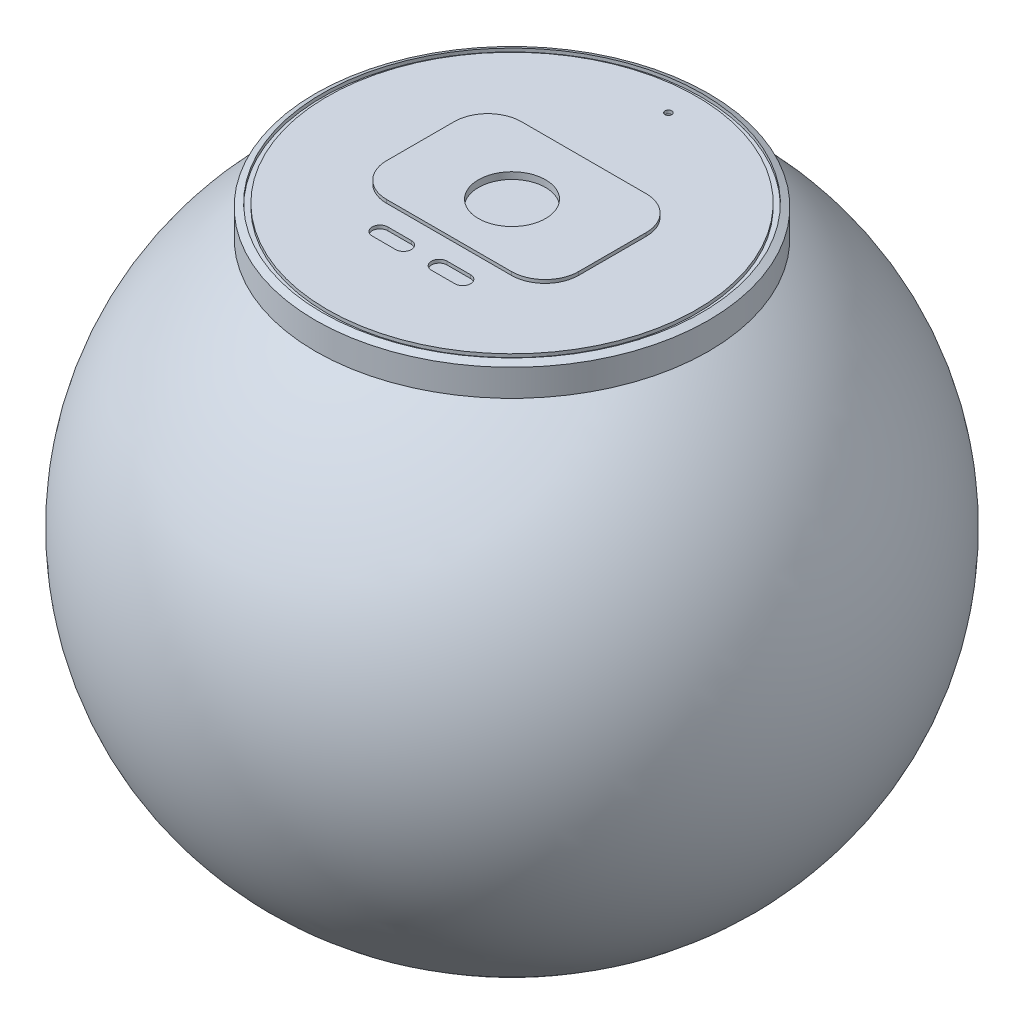
from build123d import *

# Parameters (mm, degrees)
CUT_EXTRUDE1_DEPTH      = 86.356590332
CUT_EXTRUDE1_DEPTH_BACK = 86.356590332
SKETCH9_R               = 28.237117721
BOSS_EXTRUDE3_DEPTH     = 4.5
SKETCH10_R              = 28.237117721
SKETCH10_R_2            = 27.47603731
CUT_EXTRUDE2_DEPTH      = 0.5
CUT_EXTRUDE4_DEPTH      = 0.5
CUT_EXTRUDE5_DEPTH      = 0.5
BOSS_EXTRUDE5_DEPTH     = 0.5
CUT_EXTRUDE7_DEPTH      = 0.5
CUT_EXTRUDE7_DEPTH_BACK = 0.5
SKETCH11_11_R           = 5
SKETCH11_12_R           = 0.5
CUT_EXTRUDE8_DEPTH      = 0.5


with BuildPart() as part:
    # Sketch1 → Revolve1 (revolve)
    with BuildSketch(Plane.XY):
        with BuildLine():
            Line((0, 49.509049853), (0, -35))
            Line((0, -35), (-25.272030651, -35))
            ThreePointArc((-25.272030651, -35), (-47.186298393, 17.586623254), (0, 49.509049853))
        make_face()
    revolve(axis=Axis((0, 0, 0), (0, 1, 0)))

    # Sketch2 → Cut-Extrude1 (cut, two sides: drawn at the far end of the back side and taken through both)
    with BuildSketch(Plane.XY.offset(-CUT_EXTRUDE1_DEPTH_BACK)):
        Polygon((57.527772065, 42), (57.527772065, 50), (-10, 50), (-49.614603295, 50), (-49.614603295, 42), align=None)
    extrude(amount=CUT_EXTRUDE1_DEPTH + CUT_EXTRUDE1_DEPTH_BACK, mode=Mode.SUBTRACT)

    # Sketch8 → Revolve2 (revolve)
    with BuildSketch(Plane.XY):
        Polygon((-29.237117721, 42), (-29.237117721, 46), (-28.237117721, 46.5), (-28.237117721, 42), align=None)
    revolve(axis=Axis((0, 0, 0), (0, 1, 0)))

    # Sketch9 → Boss-Extrude3 (add)
    with BuildSketch(Plane(origin=(0, 42, 0), x_dir=(1, 0, 0), z_dir=(0, 1, 0))):
        Circle(SKETCH9_R)
    extrude(amount=BOSS_EXTRUDE3_DEPTH)

    # Sketch10 → Cut-Extrude2 (cut)
    with BuildSketch(Plane(origin=(0, 46.5, 0), x_dir=(1, 0, 0), z_dir=(0, 1, 0))):
        Circle(SKETCH10_R)
        Circle(SKETCH10_R_2, mode=Mode.SUBTRACT)
    extrude(amount=-CUT_EXTRUDE2_DEPTH, mode=Mode.SUBTRACT)

    # Sketch11 → Cut-Extrude4 (cut)
    with BuildSketch(Plane(origin=(0, 46.5, 0), x_dir=(1, 0, 0), z_dir=(0, 1, 0))):
        with BuildLine():
            Line((-2.662439007, -12.315535384), (-6.158792876, -12.315535384))
            ThreePointArc((-6.158792876, -12.315535384), (-7.326955988, -13.483698497), (-6.158792876, -14.651861609))
            Line((-6.158792876, -14.651861609), (-2.662439007, -14.651861609))
            ThreePointArc((-2.662439007, -14.651861609), (-1.494275894, -13.483698497), (-2.662439007, -12.315535384))
        make_face()
    extrude(amount=-CUT_EXTRUDE4_DEPTH, mode=Mode.SUBTRACT)

    # Sketch11<7> → Cut-Extrude5 (cut)
    with BuildSketch(Plane(origin=(0, 46.5, 0), x_dir=(1, 0, 0), z_dir=(0, 1, 0))):
        with BuildLine():
            Line((2.662439007, -12.315535384), (6.158792876, -12.315535384))
            ThreePointArc((6.158792876, -12.315535384), (7.326955988, -13.483698497), (6.158792876, -14.651861609))
            Line((6.158792876, -14.651861609), (2.662439007, -14.651861609))
            ThreePointArc((2.662439007, -14.651861609), (1.494275894, -13.483698497), (2.662439007, -12.315535384))
        make_face()
    extrude(amount=-CUT_EXTRUDE5_DEPTH, mode=Mode.SUBTRACT)

    # Sketch11<10> → Boss-Extrude5 (add)
    with BuildSketch(Plane(origin=(0, 46.5, 0), x_dir=(1, 0, 0), z_dir=(0, 1, 0))):
        with BuildLine():
            Line((9.284761758, 10.683638038), (-9.284761758, 10.683638038))
            ThreePointArc((-9.284761758, 10.683638038), (-12.820295664, 9.219171944), (-14.284761758, 5.683638038))
            Line((-14.284761758, 5.683638038), (-14.284761758, -4.367615893))
            ThreePointArc((-14.284761758, -4.367615893), (-12.820295664, -7.903149799), (-9.284761758, -9.367615893))
            Line((-9.284761758, -9.367615893), (9.284761758, -9.367615893))
            ThreePointArc((9.284761758, -9.367615893), (12.820295664, -7.903149799), (14.284761758, -4.367615893))
            Line((14.284761758, -4.367615893), (14.284761758, 5.683638038))
            ThreePointArc((14.284761758, 5.683638038), (12.820295664, 9.219171944), (9.284761758, 10.683638038))
        make_face()
    extrude(amount=BOSS_EXTRUDE5_DEPTH)

    # Sketch11<11> → Cut-Extrude7 (cut, two sides: drawn at the far end of the back side and taken through both)
    with BuildSketch(Plane(origin=(0, 46.5, 0), x_dir=(1, 0, 0), z_dir=(0, 1, 0)).offset(-CUT_EXTRUDE7_DEPTH_BACK)):
        Circle(SKETCH11_11_R)
    extrude(amount=CUT_EXTRUDE7_DEPTH + CUT_EXTRUDE7_DEPTH_BACK, mode=Mode.SUBTRACT)

    # Sketch11<12> → Cut-Extrude8 (cut)
    with BuildSketch(Plane(origin=(0, 46.5, 0), x_dir=(1, 0, 0), z_dir=(0, 1, 0))):
        with Locations((0, 23.265511796)):
            Circle(SKETCH11_12_R)
    extrude(amount=-CUT_EXTRUDE8_DEPTH, mode=Mode.SUBTRACT)


solid = part.part
